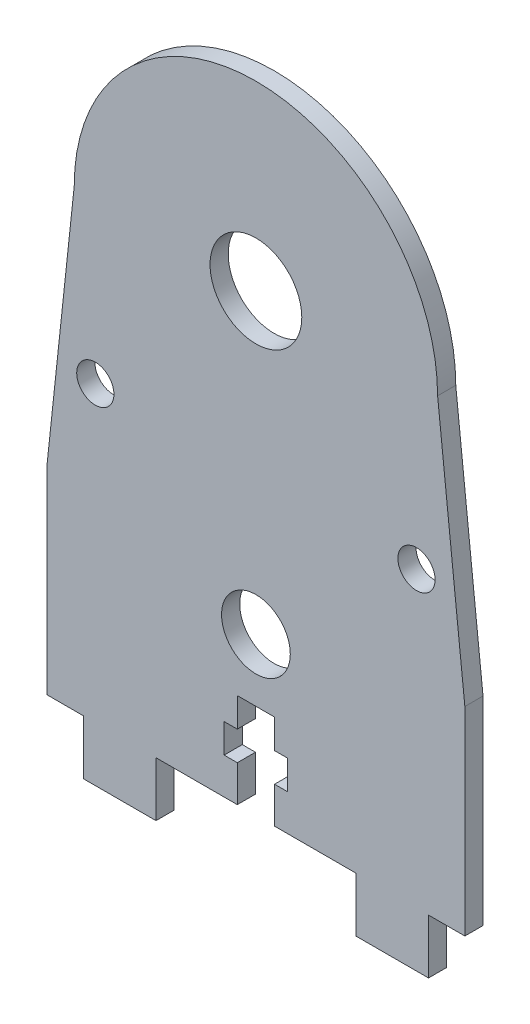
from build123d import *

# Parameters (mm, degrees)
SKETCH_1_R      = 5.05
SKETCH_1_R_2    = 2.05
SKETCH_1_R_3    = 3.783876232
EXTRUDE_1_DEPTH = 2


with BuildPart() as part:
    # 草图1 → 凸台-拉伸1 (new body)
    with BuildSketch(Plane.XY):
        with BuildLine():
            Line((-5.587732913, 20.736278596), (-5.587732913, 24.736278596))
            Line((-5.587732913, 24.736278596), (-4.137732913, 24.736278596))
            Line((-4.137732913, 24.736278596), (-4.137732913, 27.936278596))
            Line((-4.137732913, 27.936278596), (-5.587732913, 27.936278596))
            Line((-5.587732913, 27.936278596), (-5.587732913, 31.136278596))
            Line((-5.587732913, 31.136278596), (-9.687732913, 31.136278596))
            Line((-9.687732913, 31.136278596), (-9.687732913, 27.936278596))
            Line((-9.687732913, 27.936278596), (-11.137732913, 27.936278596))
            Line((-11.137732913, 27.936278596), (-11.137732913, 24.736278596))
            Line((-11.137732913, 24.736278596), (-9.687732913, 24.736278596))
            Line((-9.687732913, 24.736278596), (-9.687732913, 20.736278596))
            Line((-9.687732913, 20.736278596), (-18.637732913, 20.736278596))
            Line((-18.637732913, 20.736278596), (-18.637732913, 14.736278596))
            Line((-18.637732913, 14.736278596), (-26.637732913, 14.736278596))
            Line((-26.637732913, 14.736278596), (-26.637732913, 20.736278596))
            Line((-26.637732913, 20.736278596), (-30.637732913, 20.736278596))
            Line((-30.637732913, 20.736278596), (-30.637732913, 42.62233047))
            Line((-30.637732913, 42.62233047), (-27.637732913, 70.736278596))
            ThreePointArc((-27.637732913, 70.736278596), (-7.637732913, 90.736278596), (12.362267087, 70.736278596))
            Line((12.362267087, 70.736278596), (15.362267087, 42.62233047))
            Line((15.362267087, 42.62233047), (15.362267087, 20.736278596))
            Line((15.362267087, 20.736278596), (11.362267087, 20.736278596))
            Line((11.362267087, 20.736278596), (11.362267087, 14.736278596))
            Line((11.362267087, 14.736278596), (3.362267087, 14.736278596))
            Line((3.362267087, 14.736278596), (3.362267087, 20.736278596))
            Line((3.362267087, 20.736278596), (-5.587732913, 20.736278596))
        make_face()
        with Locations((-7.637732913, 70.736278596)):
            Circle(SKETCH_1_R, mode=Mode.SUBTRACT)
        with Locations((10.039936617, 53.058609066)):
            Circle(SKETCH_1_R_2, mode=Mode.SUBTRACT)
        with Locations(Location((-25.315402443, 53.058609066, 0), (0, 0, 180))):
            Circle(SKETCH_1_R_2, mode=Mode.SUBTRACT)
        with Locations((-7.637732913, 38.004477847)):
            Circle(SKETCH_1_R_3, mode=Mode.SUBTRACT)
    extrude(amount=EXTRUDE_1_DEPTH)


solid = part.part
